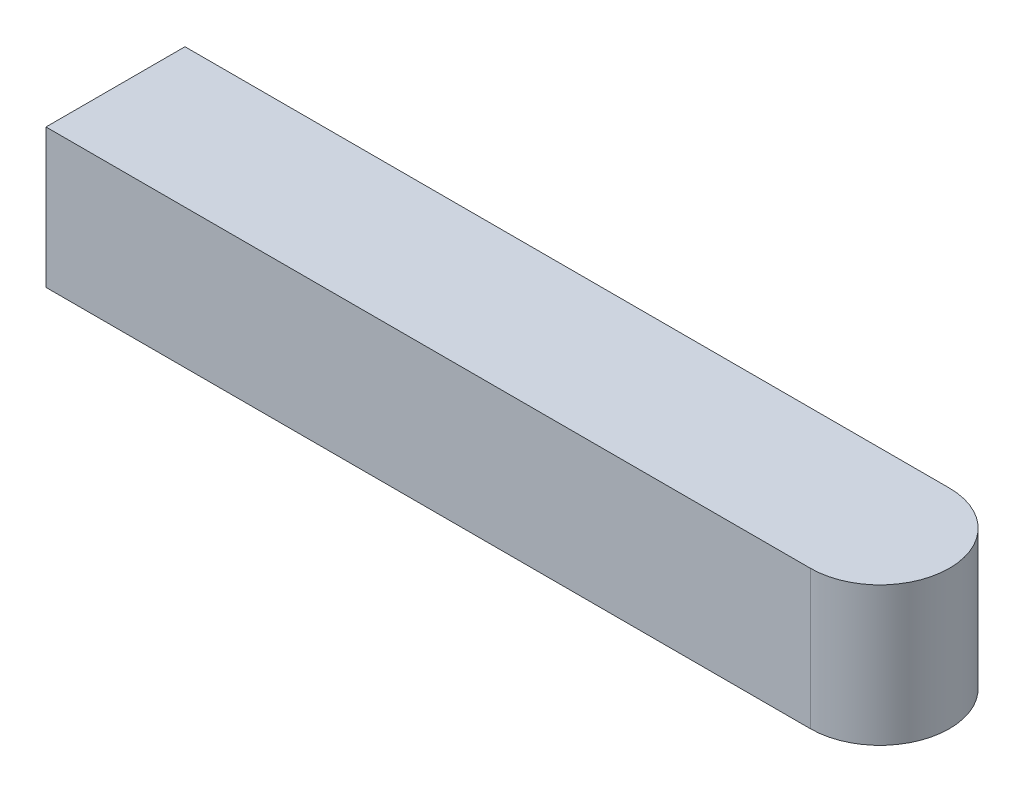
from build123d import *

# Parameters (mm, degrees)
EXTRUDE_1_DEPTH = 2.5


with BuildPart() as part:
    # ｽｹｯﾁ1 → ﾎﾞｽ - 押し出し1 (new, symmetric)
    with BuildSketch(Plane(origin=(0, 0, 0), x_dir=(1, 0, 0), z_dir=(0, 1, 0))):
        with BuildLine():
            Line((-13.75, 2.5), (13.75, 2.5))
            ThreePointArc((13.75, 2.5), (16.25, 0), (13.75, -2.5))
            Line((13.75, -2.5), (-13.75, -2.5))
            Line((-13.75, -2.5), (-13.75, 2.5))
        make_face()
    extrude(amount=EXTRUDE_1_DEPTH, both=True)


solid = part.part
